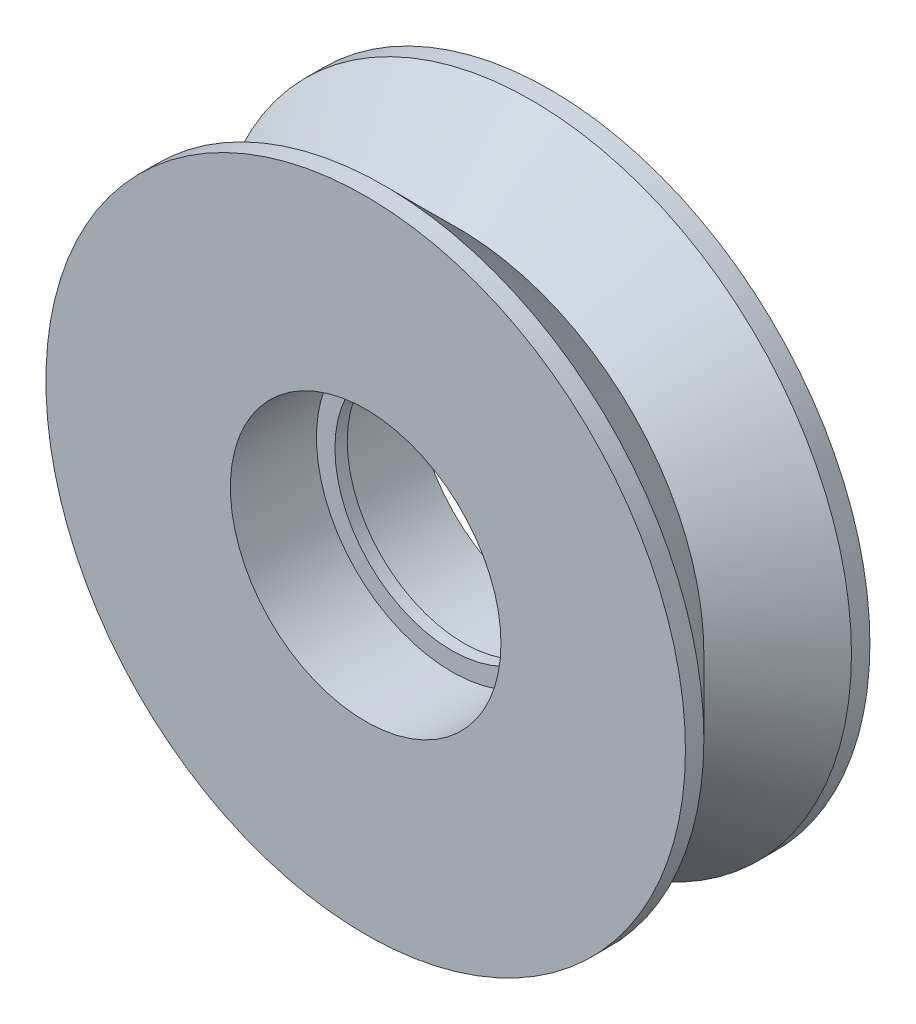
from build123d import *


with BuildPart() as part:
    # 草图1 → 旋转1 (revolve)
    with BuildSketch(Plane(origin=(0, 0, 0), x_dir=(1, 0, 0), z_dir=(0, 1, 0))):
        Polygon((11, 0), (26, 0), (26, 1.5), (20, 7.5), (26, 13.5), (26, 15), (11, 15), (11, 8), (9.5, 8), (9.5, 7), (11, 7), align=None)
    revolve(axis=Axis((0, 0, 5), (0, 0, -1)))


solid = part.part
